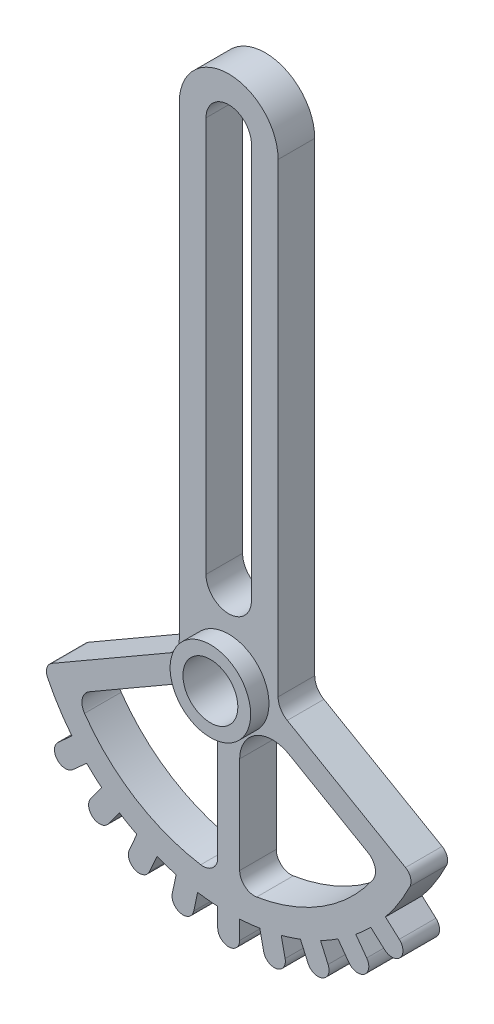
from build123d import *

# Parameters (mm, degrees)
BOSS_EXTRUDE1_DEPTH             = 5
SKETCH5_R                       = 11
SKETCH5_R_2                     = 7.5
BOSS_EXTRUDE3_DEPTH             = 10
CUT_EXTRUDE2_DEPTH              = 153.503443209
CUT_EXTRUDE2_DEPTH_BACK         = 153.503443209
SKETCH5_2_R                     = 7.5
FILLET1_R                       = 3
FILLET2_R                       = 3
FILLET3_R                       = 5
BOSS_EXTRUDE4_DEPTH             = 5
CIRPATTERN1_COUNT               = 5
CIRPATTERN1_ANGLE               = 48
CIRPATTERN1_THE_OTHER_WAY_COUNT = 5
CIRPATTERN1_THE_OTHER_WAY_ANGLE = 48
CUT_EXTRUDE3_DEPTH              = 153.221550408


with BuildPart() as part:
    # Sketch1 → Boss-Extrude1 (new, symmetric)
    with BuildSketch(Plane.XY):
        with BuildLine():
            Line((-13.5, 0), (-13.5, 130))
            ThreePointArc((-13.5, 130), (0, 143.5), (13.5, 130))
            Line((13.5, 130), (13.5, 0))
            Line((13.5, 0), (50.646324553, -21.44644048))
            ThreePointArc((50.646324553, -21.44644048), (0, -55), (-50.646324553, -21.44644048))
            Line((-50.646324553, -21.44644048), (-13.5, 0))
        make_face()
        with BuildLine():
            Line((6.2, 130), (6.2, 22))
            ThreePointArc((6.2, 22), (0, 15.8), (-6.2, 22))
            Line((-6.2, 22), (-6.2, 130))
            ThreePointArc((-6.2, 130), (0, 136.2), (6.2, 130))
        make_face(mode=Mode.SUBTRACT)
    extrude(amount=BOSS_EXTRUDE1_DEPTH, both=True)

    # Sketch5 → Boss-Extrude3 (add)
    with BuildSketch(Plane.XY):
        Circle(SKETCH5_R)
        Circle(SKETCH5_R_2, mode=Mode.SUBTRACT)
    extrude(amount=BOSS_EXTRUDE3_DEPTH)

    # Sketch5<2> → Cut-Extrude2 (cut, two sides: drawn at the far end of the back side and taken through both)
    with BuildSketch(Plane.XY.offset(-CUT_EXTRUDE2_DEPTH_BACK)):
        Circle(SKETCH5_2_R)
    extrude(amount=CUT_EXTRUDE2_DEPTH + CUT_EXTRUDE2_DEPTH_BACK, mode=Mode.SUBTRACT)

    # Fillet1
    fillet1_edges = [part.edges().sort_by_distance(p)[0] for p in [
        (-7.5, 0, -5),
    ]]
    fillet(fillet1_edges, radius=FILLET1_R)

    # Fillet2
    fillet2_edges = [part.edges().sort_by_distance(p)[0] for p in [
        (50.646324553, -21.44644048, 0),
        (-50.646324553, -21.44644048, 0),
    ]]
    fillet(fillet2_edges, radius=FILLET2_R)

    # Fillet3
    fillet3_edges = [part.edges().sort_by_distance(p)[0] for p in [
        (13.5, 0, 0),
        (-13.5, 0, 0),
    ]]
    fillet(fillet3_edges, radius=FILLET3_R)

    # Sketch4 → Boss-Extrude4 (add, symmetric)
    with BuildSketch(Plane.XY):
        with BuildLine():
            Line((-3, -54.918120871), (-3, -60))
            ThreePointArc((-3, -60), (0, -63), (3, -60))
            Line((3, -60), (3, -54.918120871))
            ThreePointArc((3, -54.918120871), (0, -55), (-3, -54.918120871))
        make_face()
    boss_extrude4 = extrude(amount=BOSS_EXTRUDE4_DEPTH, both=True)

    # CirPattern1: Boss-Extrude4 ×5 about axis
    cirpattern1_axis = Axis((0, 0, 0), (0, 0, 1))
    for i in range(1, CIRPATTERN1_COUNT):
        add(boss_extrude4.rotate(cirpattern1_axis, i * CIRPATTERN1_ANGLE / (CIRPATTERN1_COUNT - 1)))

    # CirPattern1 the other way: Boss-Extrude4 ×5 about axis
    cirpattern1_the_other_way_axis = Axis((0, 0, 0), (0, 0, -1))
    for i in range(1, CIRPATTERN1_THE_OTHER_WAY_COUNT):
        add(boss_extrude4.rotate(cirpattern1_the_other_way_axis, i * CIRPATTERN1_THE_OTHER_WAY_ANGLE / (CIRPATTERN1_THE_OTHER_WAY_COUNT - 1)))

    # Sketch6 → Cut-Extrude3 (cut, symmetric)
    with BuildSketch(Plane.XY):
        with BuildLine():
            Line((-3, -17.031832941), (-3, -43.439613258))
            ThreePointArc((-3, -43.439613258), (-4.406301342, -46.484728571), (-7.636363636, -47.388669009))
            ThreePointArc((-7.636363636, -47.388669009), (-25.530206329, -40.647368486), (-39.372516761, -27.45550808))
            ThreePointArc((-39.372516761, -27.45550808), (-39.995817984, -24.298011443), (-38.091473697, -21.703447458))
            Line((-38.091473697, -21.703447458), (-16.5, -9.237604307))
            ThreePointArc((-16.5, -9.237604307), (-7.5, -9.237604307), (-3, -17.031832941))
        make_face()
    cut_extrude3 = extrude(amount=CUT_EXTRUDE3_DEPTH, both=True, mode=Mode.SUBTRACT)

    # Mirror1: Cut-Extrude3 across plane
    add(cut_extrude3.mirror(Plane(origin=(0, 0, 0), x_dir=(0, 0, 1), z_dir=(1, 0, 0))), mode=Mode.SUBTRACT)


solid = part.part
